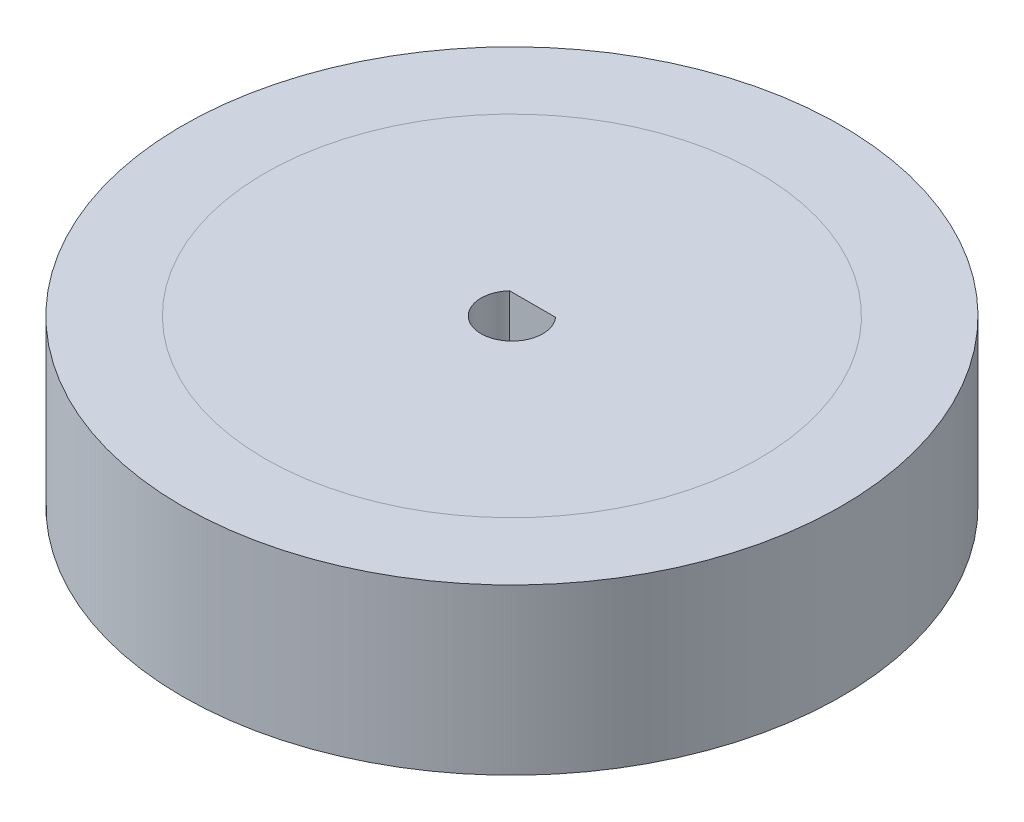
from build123d import *

# Parameters (mm, degrees)
SKETCH_1_R      = 12
EXTRUDE_1_DEPTH = 8
SKETCH_2_R      = 16
SKETCH_2_R_2    = 12
EXTRUDE_2_DEPTH = 8


with BuildPart() as part:
    # 草图1 → 凸台-拉伸1 (new body)
    with BuildSketch(Plane(origin=(0, 0, 0), x_dir=(1, 0, 0), z_dir=(0, 1, 0))):
        with Locations(Location((0, 0, 0), (0, 0, 270))):
            Circle(SKETCH_1_R)
        with BuildLine():
            Line((-1.118033989, 1), (1.118033989, 1))
            ThreePointArc((1.118033989, 1), (0, -1.5), (-1.118033989, 1))
        make_face(mode=Mode.SUBTRACT)
    extrude(amount=EXTRUDE_1_DEPTH)


with BuildPart() as body_2:
    # 草图2 → 凸台-拉伸2 (new body)
    with BuildSketch(Plane(origin=(0, 8, 0), x_dir=(1, 0, 0), z_dir=(0, 1, 0))):
        with Locations(Location((0, 0, 0), (0, 0, 270))):
            Circle(SKETCH_2_R)
        with Locations(Location((0, 0, 0), (0, 0, 270))):
            Circle(SKETCH_2_R_2, mode=Mode.SUBTRACT)
    extrude(amount=-EXTRUDE_2_DEPTH)


solid = Compound([part.part, body_2.part])
